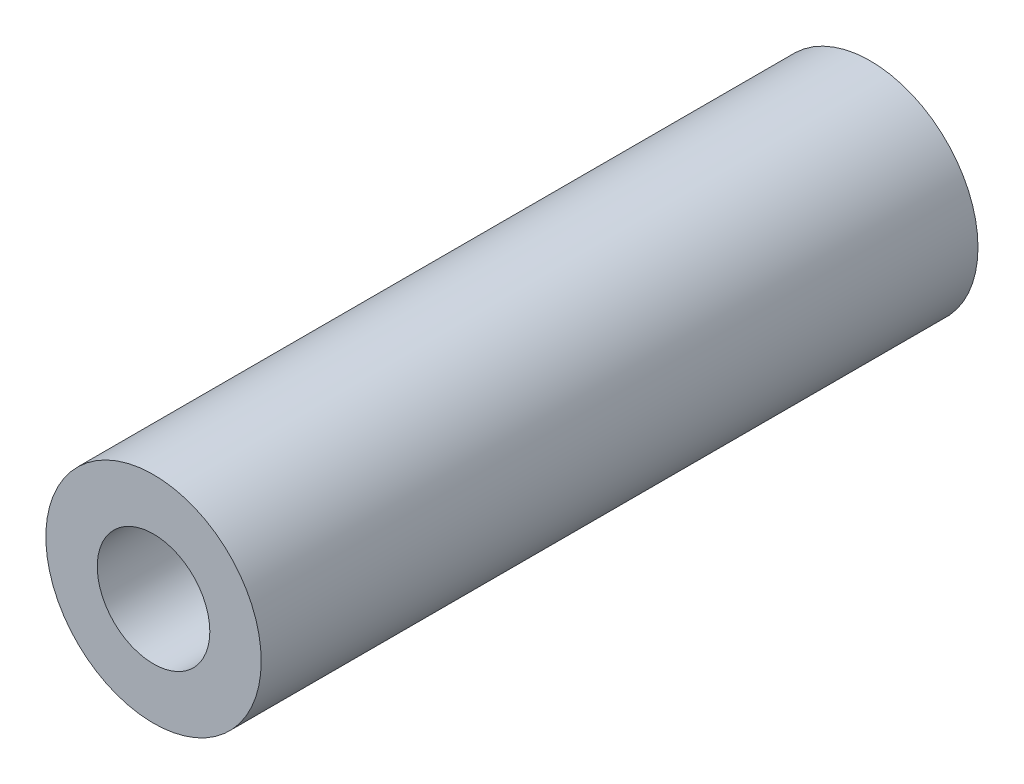
from build123d import *

# Parameters (mm, degrees)
SKETCH1_R           = 4.7625
SKETCH1_R_2         = 2.4892
BOSS_EXTRUDE1_DEPTH = 15.8496


with BuildPart() as part:
    # Sketch1 → Boss-Extrude1 (new, symmetric)
    with BuildSketch(Plane.XY):
        Circle(SKETCH1_R)
        Circle(SKETCH1_R_2, mode=Mode.SUBTRACT)
    extrude(amount=BOSS_EXTRUDE1_DEPTH, both=True)


solid = part.part
